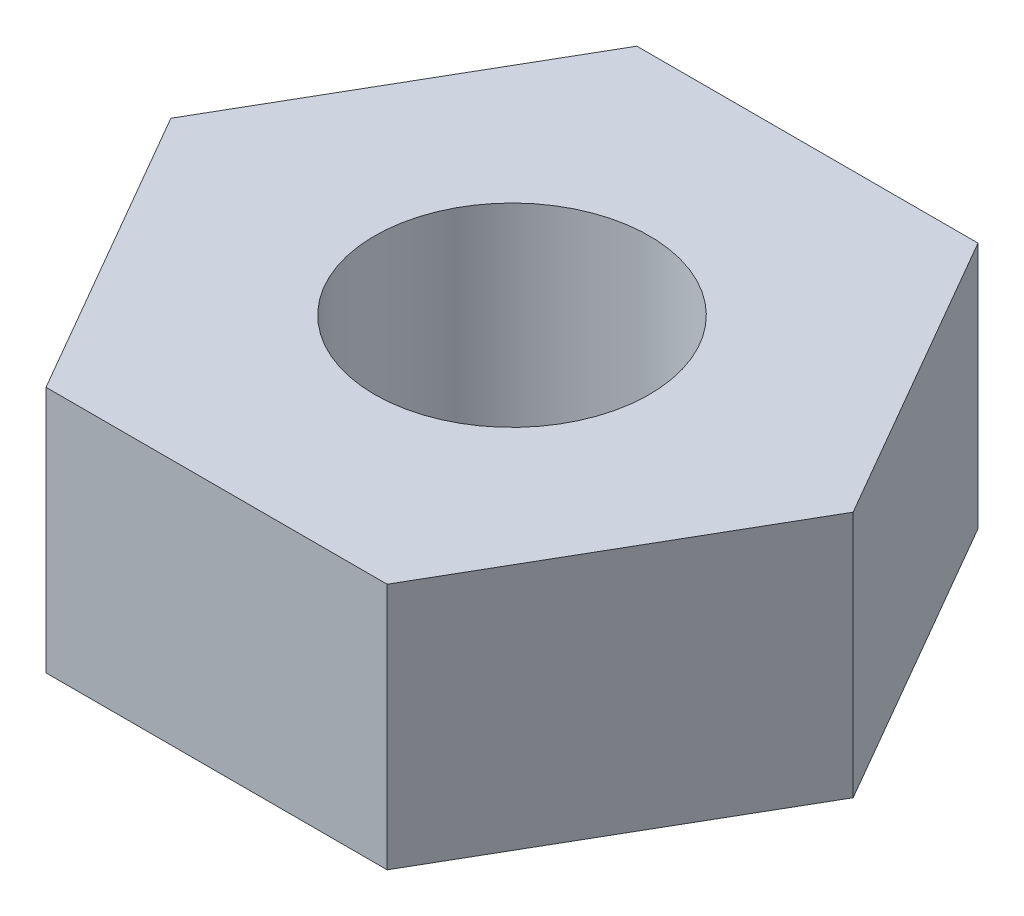
from build123d import *

# Parameters (mm, degrees)
SKETCH1_R           = 2
BOSS_EXTRUDE1_DEPTH = 3.6


with BuildPart() as part:
    # Sketch1 → Boss-Extrude1 (new body)
    with BuildSketch(Plane(origin=(0, 0, 0), x_dir=(1, 0, 0), z_dir=(0, 1, 0))):
        Polygon((4.965212315, 0), (2.482606158, 4.3), (-2.482606158, 4.3), (-4.965212315, 0), (-2.482606158, -4.3), (2.482606158, -4.3), align=None)
        with Locations(Location((0, 0, 0), (0, 0, 270))):
            Circle(SKETCH1_R, mode=Mode.SUBTRACT)
    extrude(amount=BOSS_EXTRUDE1_DEPTH)


solid = part.part
